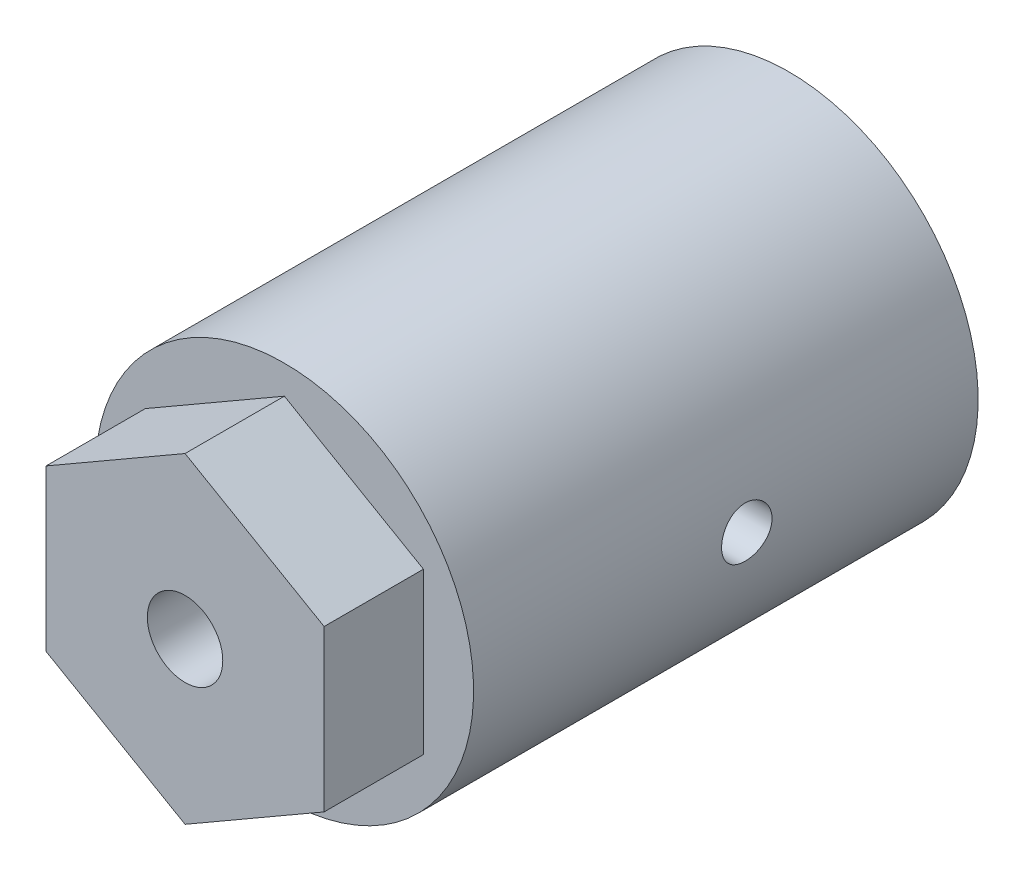
from build123d import *

# Parameters (mm, degrees)
BOSS_EXTRUDE2_DEPTH        = 5
SKETCH2_R                  = 9.525
BOSS_EXTRUDE3_DEPTH        = 25.4
SKETCH3_R                  = 3.96875
CUT_EXTRUDE1_DEPTH         = 19.05
SKETCH4_R                  = 1.27
CUT_EXTRUDE2_DEPTH         = 19.05
F_10_24_TAPPED_HOLE1_D     = 3.7973
F_10_24_TAPPED_HOLE1_DEPTH = 14.95
F_10_24_TAPPED_HOLE1_TIP   = 1.140824014
SKETCH6_R                  = 1.27
CUT_EXTRUDE3_DEPTH         = 8


with BuildPart() as part:
    # Sketch1 → Boss-Extrude2 (new body)
    with BuildSketch(Plane.XY):
        Polygon((0, 8.082903769), (-7, 4.041451884), (-7, -4.041451884), (0, -8.082903769), (7, -4.041451884), (7, 4.041451884), align=None)
    extrude(amount=BOSS_EXTRUDE2_DEPTH)

    # Sketch2 → Boss-Extrude3 (add)
    with BuildSketch(Plane(origin=(0, 0, 0), x_dir=(-1, 0, 0), z_dir=(0, 0, -1))):
        Circle(SKETCH2_R)
    extrude(amount=BOSS_EXTRUDE3_DEPTH)

    # Sketch3 → Cut-Extrude1 (cut)
    with BuildSketch(Plane(origin=(0, 0, -25.4), x_dir=(-1, 0, 0), z_dir=(0, 0, -1))):
        Circle(SKETCH3_R)
    extrude(amount=-CUT_EXTRUDE1_DEPTH, mode=Mode.SUBTRACT)

    # Sketch4 → Cut-Extrude2 (cut)
    with BuildSketch(Plane.XY.offset(5)):
        Circle(SKETCH4_R)
    extrude(amount=-CUT_EXTRUDE2_DEPTH, mode=Mode.SUBTRACT)

    # #10-24 Tapped Hole1
    with Locations(Plane.XY.offset(5)):
        with Locations((0, 0)):
            Hole(F_10_24_TAPPED_HOLE1_D / 2, depth=F_10_24_TAPPED_HOLE1_DEPTH)
            with Locations((0, 0, -(F_10_24_TAPPED_HOLE1_DEPTH + F_10_24_TAPPED_HOLE1_TIP / 2))):  # 118° drill point
                Cone(0, F_10_24_TAPPED_HOLE1_D / 2, F_10_24_TAPPED_HOLE1_TIP, mode=Mode.SUBTRACT)

    # Sketch6 → Cut-Extrude3 (cut)
    with BuildSketch(Plane(origin=(9.525, 0, 0), x_dir=(0, 0, -1), z_dir=(1, 0, 0))):
        with Locations((13.755140778, 0)):
            Circle(SKETCH6_R)
    extrude(amount=-CUT_EXTRUDE3_DEPTH, mode=Mode.SUBTRACT)


solid = part.part
